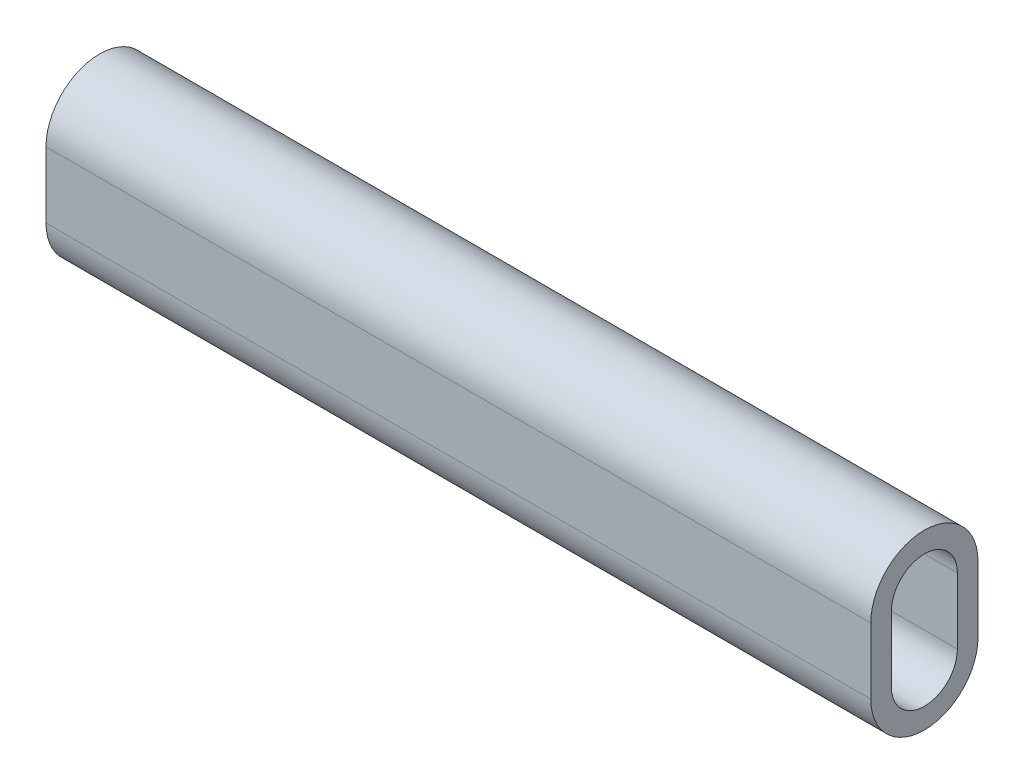
from build123d import *

# Parameters (mm, degrees)
BOSS_EXTRUDE1_DEPTH = 20


with BuildPart() as part:
    # Sketch1 → Boss-Extrude1 (new body)
    with BuildSketch(Plane(origin=(0, 0, 0), x_dir=(0, 0, -1), z_dir=(1, 0, 0))):
        with BuildLine():
            Line((-1.3, -0.8), (-1.3, 0.8))
            ThreePointArc((-1.3, 0.8), (0, 2.1), (1.3, 0.8))
            Line((1.3, 0.8), (1.3, -0.8))
            ThreePointArc((1.3, -0.8), (0, -2.1), (-1.3, -0.8))
        make_face()
        with BuildLine():
            Line((-0.8, -0.8), (-0.8, 0.8))
            ThreePointArc((-0.8, 0.8), (0, 1.6), (0.8, 0.8))
            Line((0.8, 0.8), (0.8, -0.8))
            ThreePointArc((0.8, -0.8), (0, -1.6), (-0.8, -0.8))
        make_face(mode=Mode.SUBTRACT)
    extrude(amount=BOSS_EXTRUDE1_DEPTH)


solid = part.part
